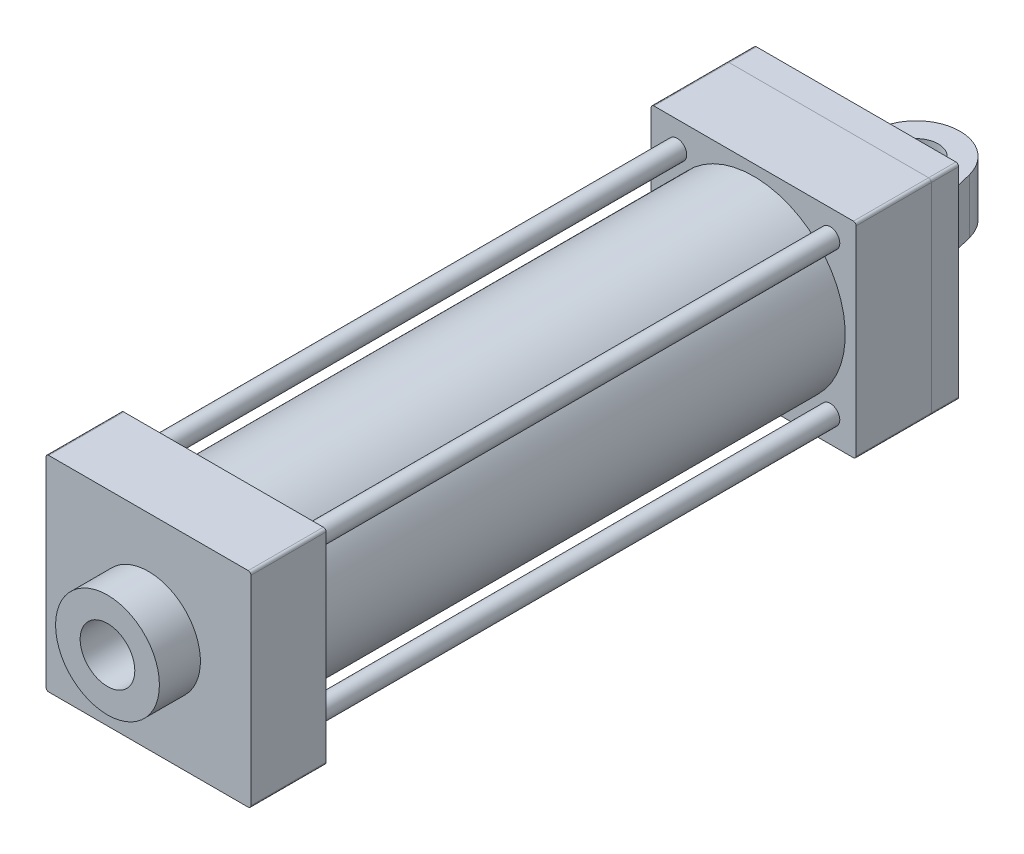
from build123d import *

# Parameters (mm, degrees)
SKETCH1_W                = 75
SKETCH1_H                = 75
BOSS_EXTRUDE1_DEPTH      = 27.5
SKETCH2_R                = 33.5
BOSS_EXTRUDE2_DEPTH      = 194
SKETCH3_W                = 75
SKETCH3_H                = 75
BOSS_EXTRUDE3_DEPTH      = 27.5
SKETCH4_R                = 3.5
BOSS_EXTRUDE4_DEPTH      = 234.5
SKETCH5_R                = 4
CUT_EXTRUDE1_DEPTH       = 19.5
FILLET1_R                = 1
SKETCH6_R                = 19
BOSS_EXTRUDE5_DEPTH      = 15
SKETCH7_R                = 10
CUT_EXTRUDE2_DEPTH       = 300
SKETCH9_R                = 4
BOSS_EXTRUDE6_DEPTH      = 10
BOSS_EXTRUDE7_DEPTH      = 10
BOSS_EXTRUDE7_DEPTH_BACK = 10
SKETCH10_R               = 8


with BuildPart() as part:
    # Sketch1 → Boss-Extrude1 (new body)
    with BuildSketch(Plane.XY):
        Rectangle(SKETCH1_W, SKETCH1_H)
    extrude(amount=BOSS_EXTRUDE1_DEPTH)

    # Sketch2 → Boss-Extrude2 (add)
    with BuildSketch(Plane.XY.offset(27.5)):
        with Locations(Location((0, 0, 0), (0, 0, 180))):
            Circle(SKETCH2_R)
    extrude(amount=BOSS_EXTRUDE2_DEPTH)

    # Sketch3 → Boss-Extrude3 (add)
    with BuildSketch(Plane.XY.offset(221.5)):
        Rectangle(SKETCH3_W, SKETCH3_H)
    extrude(amount=BOSS_EXTRUDE3_DEPTH)

    # Sketch4 → Boss-Extrude4 (add)
    with BuildSketch(Plane.XY.offset(249)):
        with Locations(Location((-28, 28, 0), (0, 0, 180))):
            Circle(SKETCH4_R)
        with Locations(Location((28, 28, 0), (0, 0, 180))):
            Circle(SKETCH4_R)
        with Locations(Location((28, -28, 0), (0, 0, 180))):
            Circle(SKETCH4_R)
        with Locations(Location((-28, -28, 0), (0, 0, 180))):
            Circle(SKETCH4_R)
    extrude(amount=-BOSS_EXTRUDE4_DEPTH)

    # Sketch5 → Cut-Extrude1 (cut)
    with BuildSketch(Plane(origin=(0, 0, 0), x_dir=(-1, 0, 0), z_dir=(0, 0, -1))):
        with Locations((-28, 28)):
            Circle(SKETCH5_R)
        with Locations((28, 28)):
            Circle(SKETCH5_R)
        with Locations((28, -28)):
            Circle(SKETCH5_R)
        with Locations((-28, -28)):
            Circle(SKETCH5_R)
    extrude(amount=-CUT_EXTRUDE1_DEPTH, mode=Mode.SUBTRACT)

    # Fillet1
    fillet1_edges = [part.edges().sort_by_distance(p)[0] for p in [
        (37.5, -37.5, 235.25),
        (37.5, 37.5, 235.25),
        (-37.5, 37.5, 235.25),
        (-37.5, -37.5, 235.25),
        (37.5, -37.5, 13.75),
        (-37.5, -37.5, 13.75),
        (-37.5, 37.5, 13.75),
        (37.5, 37.5, 13.75),
    ]]
    fillet(fillet1_edges, radius=FILLET1_R)

    # Sketch6 → Boss-Extrude5 (add)
    with BuildSketch(Plane.XY.offset(249)):
        with Locations(Location((0, 0, 0), (0, 0, 180))):
            Circle(SKETCH6_R)
    extrude(amount=BOSS_EXTRUDE5_DEPTH)

    # Sketch7 → Cut-Extrude2 (cut)
    with BuildSketch(Plane.XY.offset(264)):
        Circle(SKETCH7_R)
    extrude(amount=-CUT_EXTRUDE2_DEPTH, mode=Mode.SUBTRACT)


with BuildPart() as body_2:
    # Sketch9 → Boss-Extrude6 (new body)
    with BuildSketch(Plane(origin=(0, 0, 0), x_dir=(-1, 0, 0), z_dir=(0, 0, -1))):
        with BuildLine():
            Line((37.5, -36.5), (37.5, 36.5))
            ThreePointArc((37.5, 36.5), (37.207106781, 37.207106781), (36.5, 37.5))
            Line((36.5, 37.5), (-36.5, 37.5))
            ThreePointArc((-36.5, 37.5), (-37.207106781, 37.207106781), (-37.5, 36.5))
            Line((-37.5, 36.5), (-37.5, -36.5))
            ThreePointArc((-37.5, -36.5), (-37.207106781, -37.207106781), (-36.5, -37.5))
            Line((-36.5, -37.5), (36.5, -37.5))
            ThreePointArc((36.5, -37.5), (37.207106781, -37.207106781), (37.5, -36.5))
        make_face()
        with Locations((-28, 28)):
            Circle(SKETCH9_R, mode=Mode.SUBTRACT)
        with Locations((28, 28)):
            Circle(SKETCH9_R, mode=Mode.SUBTRACT)
        with Locations((28, -28)):
            Circle(SKETCH9_R, mode=Mode.SUBTRACT)
        with Locations((-28, -28)):
            Circle(SKETCH9_R, mode=Mode.SUBTRACT)
    extrude(amount=BOSS_EXTRUDE6_DEPTH)


with BuildPart() as body_3:
    # Sketch10 → Boss-Extrude7 (new, two sides: drawn at the far end of the back side and taken through both)
    with BuildSketch(Plane(origin=(0, 0, 0), x_dir=(1, 0, 0), z_dir=(0, 1, 0)).offset(-BOSS_EXTRUDE7_DEPTH_BACK)):
        with BuildLine():
            Line((-22, 10), (-15.521210228, 35.884846592))
            ThreePointArc((-15.521210228, 35.884846592), (0, 48), (15.521210228, 35.884846592))
            Line((15.521210228, 35.884846592), (22, 10))
            Line((22, 10), (-22, 10))
        make_face()
        with Locations(Location((0, 32, 0), (0, 0, 270))):
            Circle(SKETCH10_R, mode=Mode.SUBTRACT)
    extrude(amount=BOSS_EXTRUDE7_DEPTH + BOSS_EXTRUDE7_DEPTH_BACK)


solid = Compound([part.part, body_2.part, body_3.part])
